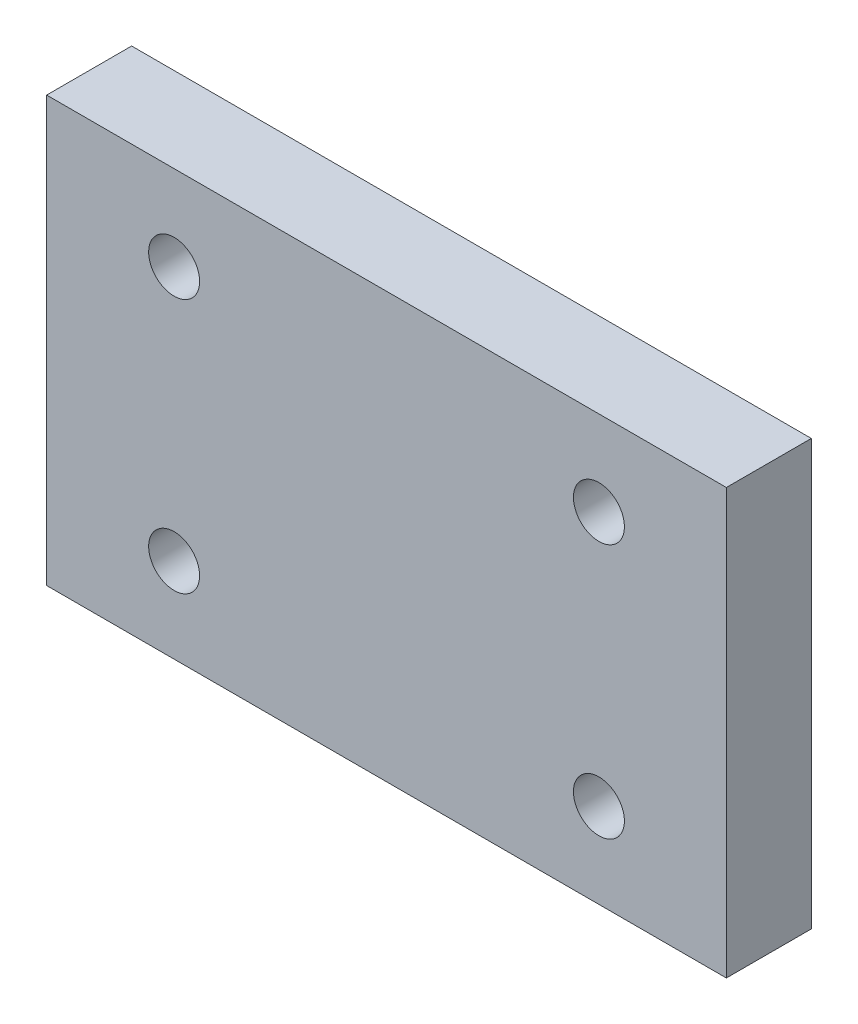
from build123d import *

# Parameters (mm, degrees)
BASE_W      = 80
BASE_H      = 50
BLOCK_DEPTH = 10
HOLES_2_R   = 3
HOLES_DEPTH = 49.218253805


with BuildPart() as part:
    # base → block (new body)
    with BuildSketch(Plane.XY):
        Rectangle(BASE_W, BASE_H)
    extrude(amount=BLOCK_DEPTH)

    # holes 2 → holes (cut, through all)
    with BuildSketch(Plane(origin=(0, 0, 10), x_dir=(-1, 0, 0), z_dir=(0, 0, -1))):
        with Locations((25, 15)):
            Circle(HOLES_2_R)
        with Locations((25, -15)):
            Circle(HOLES_2_R)
        with Locations((-25, 15)):
            Circle(HOLES_2_R)
        with Locations((-25, -15)):
            Circle(HOLES_2_R)
    extrude(amount=HOLES_DEPTH, mode=Mode.SUBTRACT)


solid = part.part
